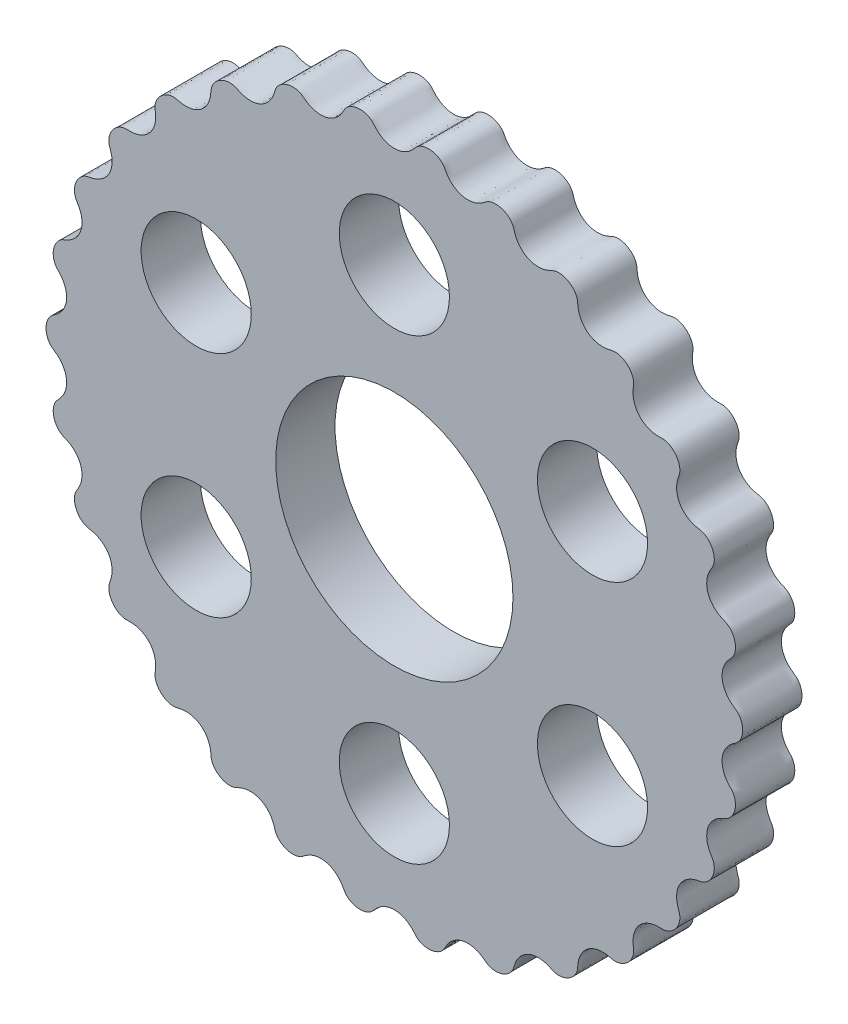
from build123d import *

# Parameters (mm, degrees)
BOSS_EXTRUDE1_DEPTH = 7
SKETCH2_R           = 14
SKETCH2_R_2         = 6.5
CUT_EXTRUDE1_DEPTH  = 7


with BuildPart() as part:
    # Sketch1 → Boss-Extrude1 (new body)
    with BuildSketch(Plane.XY):
        with BuildLine():
            add(Edge.make_bspline(
                [(0, 38.9), (-0.630492424, 38.9), (-1.507013809, 39.217935071), (-2.196153104, 39.883196365), (-2.445341751, 40.178253442), (-2.571992678, 40.32066814), (-2.681349487, 40.425517942), (-2.809944847, 40.526907485), (-2.973304425, 40.629709251), (-3.176800411, 40.727717742), (-3.419090297, 40.810842329), (-3.693708308, 40.869006469), (-3.990480724, 40.894065816), (-4.29679965, 40.881326059), (-4.599074779, 40.830101408), (-4.884145734, 40.743874526), (-5.140682904, 40.629908207), (-5.36038395, 40.498205779), (-5.539064473, 40.360040785), (-5.677478587, 40.225518623), (-5.782175767, 40.099602717), (-5.867354666, 39.974315241), (-5.961619102, 39.808677807), (-6.144029357, 39.468264415), (-6.67978179, 38.674256059), (-8.04021473, 37.826243325), (-9.62794908, 38.04759685), (-10.440343282, 38.555046737), (-10.745427864, 38.791853049), (-10.898927237, 38.904814317), (-11.027696065, 38.984639921), (-11.174563439, 39.05707845), (-11.355724996, 39.123677922), (-11.575154651, 39.177213487), (-11.829427309, 39.208171264), (-12.110136892, 39.207949424), (-12.405631967, 39.170759843), (-12.702610528, 39.094614488), (-12.987629395, 38.981660874), (-13.248547336, 38.83805817), (-13.475771321, 38.673232455), (-13.66329128, 38.498733719), (-13.809355492, 38.326450962), (-13.916762866, 38.166078742), (-13.993002198, 38.021150308), (-14.050263359, 37.88088461), (-14.108032797, 37.699271087), (-14.215666356, 37.328370118), (-14.574647139, 36.440327484), (-15.729037739, 35.328002866), (-17.328099614, 35.214402357), (-18.228241289, 35.541857222), (-18.575896924, 35.71005183), (-18.749525455, 35.788632305), (-18.89207393, 35.839947641), (-19.050792281, 35.880256959), (-19.241839885, 35.907738927), (-19.467605668, 35.91449157), (-19.722762356, 35.891901976), (-19.99729056, 35.833312388), (-20.278605163, 35.735521303), (-20.553254878, 35.599276839), (-20.808559126, 35.429535881), (-21.033921838, 35.234827937), (-21.221909066, 35.026359327), (-21.369060652, 34.816690443), (-21.476098062, 34.617793368), (-21.547821131, 34.438600482), (-21.592265955, 34.280991336), (-21.619115049, 34.131885661), (-21.637854771, 33.942226341), (-21.66604331, 33.557051812), (-21.832520165, 32.613778538), (-22.730428155, 31.285740268), (-24.270924496, 30.842182463), (-25.219480384, 30.975314203), (-25.594504604, 31.06756283), (-25.780678641, 31.108324185), (-25.930781789, 31.128871943), (-26.094413844, 31.13531433), (-26.287000211, 31.122475482), (-26.50923637, 31.082128619), (-26.754114778, 31.006973492), (-27.010474973, 30.892611245), (-27.265300867, 30.738452313), (-27.505623243, 30.54808966), (-27.720061689, 30.32897865), (-27.900002529, 30.091658833), (-28.040560543, 29.848671354), (-28.140882953, 29.612981523), (-28.2042417, 29.396183563), (-28.23713109, 29.205991222), (-28.247848028, 29.042585727), (-28.243088158, 28.891154205), (-28.222018671, 28.701741142), (-28.169464404, 28.319126135), (-28.136239068, 27.361851411), (-28.738367107, 25.876144044), (-30.152997736, 25.122009816), (-31.108501576, 25.055002809), (-31.494510984, 25.067253827), (-31.685090706, 25.068438266), (-31.836187424, 25.057314441), (-31.99758155, 25.029600509), (-32.183292364, 24.976996007), (-32.392287537, 24.891335581), (-32.616187461, 24.766902224), (-32.843161391, 24.601731654), (-33.060368836, 24.397963574), (-33.255866525, 24.161798966), (-33.420058628, 23.902890762), (-33.546730698, 23.633346789), (-33.633692193, 23.366444937), (-33.682826434, 23.115047721), (-33.699724382, 22.88981453), (-33.692358684, 22.696937821), (-33.668849388, 22.534878239), (-33.632724923, 22.387742856), (-33.572719547, 22.206853981), (-33.441777323, 21.843522023), (-33.210222344, 20.91407875), (-33.490332752, 19.335645208), (-34.717241294, 18.303883939), (-35.637930527, 18.039651465), (-36.018061641, 17.971414262), (-36.20471553, 17.932915054), (-36.35020146, 17.890648064), (-36.50230416, 17.82997369), (-36.673012169, 17.739898476), (-36.859636202, 17.612665569), (-37.052773422, 17.444402144), (-37.240456184, 17.235658559), (-37.410532347, 16.991170983), (-37.552671798, 16.719529853), (-37.65944319, 16.432137416), (-37.72730586, 16.142144457), (-37.756861629, 15.862991645), (-37.752661979, 15.606873087), (-37.722362601, 15.383046448), (-37.675063407, 15.195917324), (-37.618375899, 15.04228445), (-37.552441956, 14.905882795), (-37.456141529, 14.741418706), (-37.252521838, 14.413250075), (-36.832777932, 13.552260549), (-36.778600825, 11.950088288), (-37.764166468, 10.685752764), (-38.609822012, 10.235919989), (-38.967441031, 10.09010357), (-39.142026293, 10.01366505), (-39.275540964, 9.942060529), (-39.411699433, 9.851080188), (-39.559963175, 9.727498427), (-39.716040963, 9.564231732), (-39.869986011, 9.359501014), (-40.010148813, 9.116287907), (-40.125702225, 8.841791452), (-40.208239042, 8.546523521), (-40.252926249, 8.243215252), (-40.259023091, 7.9454517), (-40.229886252, 7.666259237), (-40.172539599, 7.416604801), (-40.096343599, 7.203975882), (-40.011174953, 7.030767617), (-39.923787782, 6.892275806), (-39.830937964, 6.77255698), (-39.702544231, 6.631715374), (-39.435149965, 6.353051366), (-38.845572855, 5.598149936), (-38.459454669, 4.042253838), (-39.160626603, 2.600635886), (-39.894274826, 1.984810097), (-40.213759659, 1.767822372), (-40.368635011, 1.656757458), (-40.484341838, 1.55895387), (-40.598616998, 1.441660628), (-40.717929888, 1.289941498), (-40.836673854, 1.097808015), (-40.944668583, 0.865531334), (-41.031208547, 0.598493773), (-41.087168402, 0.305970765), (-41.106509005, 0), (-41.087168402, -0.305970765), (-41.031208547, -0.598493773), (-40.944668583, -0.865531334), (-40.836673854, -1.097808015), (-40.717929888, -1.289941498), (-40.598616998, -1.441660628), (-40.484341838, -1.55895387), (-40.368635011, -1.656757458), (-40.213759659, -1.767822372), (-39.894274826, -1.984810097), (-39.160626603, -2.600635886), (-38.459454669, -4.042253838), (-38.845572855, -5.598149936), (-39.435149965, -6.353051366), (-39.702544231, -6.631715374), (-39.830937964, -6.77255698), (-39.923787782, -6.892275806), (-40.011174953, -7.030767617), (-40.096343599, -7.203975882), (-40.172539599, -7.416604801), (-40.229886252, -7.666259237), (-40.259023091, -7.9454517), (-40.252926249, -8.243215252), (-40.208239042, -8.546523521), (-40.125702225, -8.841791452), (-40.010148813, -9.116287907), (-39.869986011, -9.359501014), (-39.716040963, -9.564231732), (-39.559963175, -9.727498427), (-39.411699433, -9.851080188), (-39.275540964, -9.942060529), (-39.142026293, -10.01366505), (-38.967441031, -10.09010357), (-38.609822012, -10.235919989), (-37.764166468, -10.685752764), (-36.778600825, -11.950088288), (-36.832777932, -13.552260549), (-37.252521838, -14.413250075), (-37.456141529, -14.741418706), (-37.552441956, -14.905882795), (-37.618375899, -15.04228445), (-37.675063407, -15.195917324), (-37.722362601, -15.383046448), (-37.752661979, -15.606873087), (-37.756861629, -15.862991645), (-37.72730586, -16.142144457), (-37.65944319, -16.432137416), (-37.552671798, -16.719529853), (-37.410532347, -16.991170983), (-37.240456184, -17.235658559), (-37.052773422, -17.444402144), (-36.859636202, -17.612665569), (-36.673012169, -17.739898476), (-36.50230416, -17.82997369), (-36.35020146, -17.890648064), (-36.20471553, -17.932915054), (-36.018061641, -17.971414262), (-35.637930527, -18.039651465), (-34.717241294, -18.303883939), (-33.490332752, -19.335645208), (-33.210222344, -20.91407875), (-33.441777323, -21.843522023), (-33.572719547, -22.206853981), (-33.632724923, -22.387742856), (-33.668849388, -22.534878239), (-33.692358684, -22.696937821), (-33.699724382, -22.88981453), (-33.682826434, -23.115047721), (-33.633692193, -23.366444937), (-33.546730698, -23.633346789), (-33.420058628, -23.902890762), (-33.255866525, -24.161798966), (-33.060368836, -24.397963574), (-32.843161391, -24.601731654), (-32.616187461, -24.766902224), (-32.392287537, -24.891335581), (-32.183292364, -24.976996007), (-31.99758155, -25.029600509), (-31.836187424, -25.057314441), (-31.685090706, -25.068438266), (-31.494510984, -25.067253827), (-31.108501576, -25.055002809), (-30.152997736, -25.122009816), (-28.738367107, -25.876144044), (-28.136239068, -27.361851411), (-28.169464404, -28.319126135), (-28.222018671, -28.701741142), (-28.243088158, -28.891154205), (-28.247848028, -29.042585727), (-28.23713109, -29.205991222), (-28.2042417, -29.396183563), (-28.140882953, -29.612981523), (-28.040560543, -29.848671354), (-27.900002529, -30.091658833), (-27.720061689, -30.32897865), (-27.505623243, -30.54808966), (-27.265300867, -30.738452313), (-27.010474973, -30.892611245), (-26.754114778, -31.006973492), (-26.50923637, -31.082128619), (-26.287000211, -31.122475482), (-26.094413844, -31.13531433), (-25.930781789, -31.128871943), (-25.780678641, -31.108324185), (-25.594504604, -31.06756283), (-25.219480384, -30.975314203), (-24.270924496, -30.842182463), (-22.730428155, -31.285740268), (-21.832520165, -32.613778538), (-21.66604331, -33.557051812), (-21.637854771, -33.942226341), (-21.619115049, -34.131885661), (-21.592265955, -34.280991336), (-21.547821131, -34.438600482), (-21.476098062, -34.617793368), (-21.369060652, -34.816690443), (-21.221909066, -35.026359327), (-21.033921838, -35.234827937), (-20.808559126, -35.429535881), (-20.553254878, -35.599276839), (-20.278605163, -35.735521303), (-19.99729056, -35.833312388), (-19.722762356, -35.891901976), (-19.467605668, -35.91449157), (-19.241839885, -35.907738927), (-19.050792281, -35.880256959), (-18.89207393, -35.839947641), (-18.749525455, -35.788632305), (-18.575896924, -35.71005183), (-18.228241289, -35.541857222), (-17.328099614, -35.214402357), (-15.729037739, -35.328002866), (-14.574647139, -36.440327484), (-14.215666356, -37.328370118), (-14.108032797, -37.699271087), (-14.050263359, -37.88088461), (-13.993002198, -38.021150308), (-13.916762866, -38.166078742), (-13.809355492, -38.326450962), (-13.66329128, -38.498733719), (-13.475771321, -38.673232455), (-13.248547336, -38.83805817), (-12.987629395, -38.981660874), (-12.702610528, -39.094614488), (-12.405631967, -39.170759843), (-12.110136892, -39.207949424), (-11.829427309, -39.208171264), (-11.575154651, -39.177213487), (-11.355724996, -39.123677922), (-11.174563439, -39.05707845), (-11.027696065, -38.984639921), (-10.898927237, -38.904814317), (-10.745427864, -38.791853049), (-10.440343282, -38.555046737), (-9.62794908, -38.04759685), (-8.04021473, -37.826243325), (-6.67978179, -38.674256059), (-6.144029357, -39.468264415), (-5.961619102, -39.808677807), (-5.867354666, -39.974315241), (-5.782175767, -40.099602717), (-5.677478587, -40.225518623), (-5.539064473, -40.360040785), (-5.36038395, -40.498205779), (-5.140682904, -40.629908207), (-4.884145734, -40.743874526), (-4.599074779, -40.830101408), (-4.29679965, -40.881326059), (-3.990480724, -40.894065816), (-3.693708308, -40.869006469), (-3.419090297, -40.810842329), (-3.176800411, -40.727717742), (-2.973304425, -40.629709251), (-2.809944847, -40.526907485), (-2.681349487, -40.425517942), (-2.571992678, -40.32066814), (-2.445341751, -40.178253442), (-2.196153104, -39.883196365), (-1.507013809, -39.217935071), (0, -38.671305462), (1.507013809, -39.217935071), (2.196153104, -39.883196365), (2.445341751, -40.178253442), (2.571992678, -40.32066814), (2.681349487, -40.425517942), (2.809944847, -40.526907485), (2.973304425, -40.629709251), (3.176800411, -40.727717742), (3.419090297, -40.810842329), (3.693708308, -40.869006469), (3.990480724, -40.894065816), (4.29679965, -40.881326059), (4.599074779, -40.830101408), (4.884145734, -40.743874526), (5.140682904, -40.629908207), (5.36038395, -40.498205779), (5.539064473, -40.360040785), (5.677478587, -40.225518623), (5.782175767, -40.099602717), (5.867354666, -39.974315241), (5.961619102, -39.808677807), (6.144029357, -39.468264415), (6.67978179, -38.674256059), (8.04021473, -37.826243325), (9.62794908, -38.04759685), (10.440343282, -38.555046737), (10.745427864, -38.791853049), (10.898927237, -38.904814317), (11.027696065, -38.984639921), (11.174563439, -39.05707845), (11.355724996, -39.123677922), (11.575154651, -39.177213487), (11.829427309, -39.208171264), (12.110136892, -39.207949424), (12.405631967, -39.170759843), (12.702610528, -39.094614488), (12.987629395, -38.981660874), (13.248547336, -38.83805817), (13.475771321, -38.673232455), (13.66329128, -38.498733719), (13.809355492, -38.326450962), (13.916762866, -38.166078742), (13.993002198, -38.021150308), (14.050263359, -37.88088461), (14.108032797, -37.699271087), (14.215666356, -37.328370118), (14.574647139, -36.440327484), (15.729037739, -35.328002866), (17.328099614, -35.214402357), (18.228241289, -35.541857222), (18.575896924, -35.71005183), (18.749525455, -35.788632305), (18.89207393, -35.839947641), (19.050792281, -35.880256959), (19.241839885, -35.907738927), (19.467605668, -35.91449157), (19.722762356, -35.891901976), (19.99729056, -35.833312388), (20.278605163, -35.735521303), (20.553254878, -35.599276839), (20.808559126, -35.429535881), (21.033921838, -35.234827937), (21.221909066, -35.026359327), (21.369060652, -34.816690443), (21.476098062, -34.617793368), (21.547821131, -34.438600482), (21.592265955, -34.280991336), (21.619115049, -34.131885661), (21.637854771, -33.942226341), (21.66604331, -33.557051812), (21.832520165, -32.613778538), (22.730428155, -31.285740268), (24.270924496, -30.842182463), (25.219480384, -30.975314203), (25.594504604, -31.06756283), (25.780678641, -31.108324185), (25.930781789, -31.128871943), (26.094413844, -31.13531433), (26.287000211, -31.122475482), (26.50923637, -31.082128619), (26.754114778, -31.006973492), (27.010474973, -30.892611245), (27.265300867, -30.738452313), (27.505623243, -30.54808966), (27.720061689, -30.32897865), (27.900002529, -30.091658833), (28.040560543, -29.848671354), (28.140882953, -29.612981523), (28.2042417, -29.396183563), (28.23713109, -29.205991222), (28.247848028, -29.042585727), (28.243088158, -28.891154205), (28.222018671, -28.701741142), (28.169464404, -28.319126135), (28.136239068, -27.361851411), (28.738367107, -25.876144044), (30.152997736, -25.122009816), (31.108501576, -25.055002809), (31.494510984, -25.067253827), (31.685090706, -25.068438266), (31.836187424, -25.057314441), (31.99758155, -25.029600509), (32.183292364, -24.976996007), (32.392287537, -24.891335581), (32.616187461, -24.766902224), (32.843161391, -24.601731654), (33.060368836, -24.397963574), (33.255866525, -24.161798966), (33.420058628, -23.902890762), (33.546730698, -23.633346789), (33.633692193, -23.366444937), (33.682826434, -23.115047721), (33.699724382, -22.88981453), (33.692358684, -22.696937821), (33.668849388, -22.534878239), (33.632724923, -22.387742856), (33.572719547, -22.206853981), (33.441777323, -21.843522023), (33.210222344, -20.91407875), (33.490332752, -19.335645208), (34.717241294, -18.303883939), (35.637930527, -18.039651465), (36.018061641, -17.971414262), (36.20471553, -17.932915054), (36.35020146, -17.890648064), (36.50230416, -17.82997369), (36.673012169, -17.739898476), (36.859636202, -17.612665569), (37.052773422, -17.444402144), (37.240456184, -17.235658559), (37.410532347, -16.991170983), (37.552671798, -16.719529853), (37.65944319, -16.432137416), (37.72730586, -16.142144457), (37.756861629, -15.862991645), (37.752661979, -15.606873087), (37.722362601, -15.383046448), (37.675063407, -15.195917324), (37.618375899, -15.04228445), (37.552441956, -14.905882795), (37.456141529, -14.741418706), (37.252521838, -14.413250075), (36.832777932, -13.552260549), (36.778600825, -11.950088288), (37.764166468, -10.685752764), (38.609822012, -10.235919989), (38.967441031, -10.09010357), (39.142026293, -10.01366505), (39.275540964, -9.942060529), (39.411699433, -9.851080188), (39.559963175, -9.727498427), (39.716040963, -9.564231732), (39.869986011, -9.359501014), (40.010148813, -9.116287907), (40.125702225, -8.841791452), (40.208239042, -8.546523521), (40.252926249, -8.243215252), (40.259023091, -7.9454517), (40.229886252, -7.666259237), (40.172539599, -7.416604801), (40.096343599, -7.203975882), (40.011174953, -7.030767617), (39.923787782, -6.892275806), (39.830937964, -6.77255698), (39.702544231, -6.631715374), (39.435149965, -6.353051366), (38.845572855, -5.598149936), (38.459454669, -4.042253838), (39.160626603, -2.600635886), (39.894274826, -1.984810097), (40.213759659, -1.767822372), (40.368635011, -1.656757458), (40.484341838, -1.55895387), (40.598616998, -1.441660628), (40.717929888, -1.289941498), (40.836673854, -1.097808015), (40.944668583, -0.865531334), (41.031208547, -0.598493773), (41.087168402, -0.305970765), (41.106509005, 0), (41.087168402, 0.305970765), (41.031208547, 0.598493773), (40.944668583, 0.865531334), (40.836673854, 1.097808015), (40.717929888, 1.289941498), (40.598616998, 1.441660628), (40.484341838, 1.55895387), (40.368635011, 1.656757458), (40.213759659, 1.767822372), (39.894274826, 1.984810097), (39.160626603, 2.600635886), (38.459454669, 4.042253838), (38.845572855, 5.598149936), (39.435149965, 6.353051366), (39.702544231, 6.631715374), (39.830937964, 6.77255698), (39.923787782, 6.892275806), (40.011174953, 7.030767617), (40.096343599, 7.203975882), (40.172539599, 7.416604801), (40.229886252, 7.666259237), (40.259023091, 7.9454517), (40.252926249, 8.243215252), (40.208239042, 8.546523521), (40.125702225, 8.841791452), (40.010148813, 9.116287907), (39.869986011, 9.359501014), (39.716040963, 9.564231732), (39.559963175, 9.727498427), (39.411699433, 9.851080188), (39.275540964, 9.942060529), (39.142026293, 10.01366505), (38.967441031, 10.09010357), (38.609822012, 10.235919989), (37.764166468, 10.685752764), (36.778600825, 11.950088288), (36.832777932, 13.552260549), (37.252521838, 14.413250075), (37.456141529, 14.741418706), (37.552441956, 14.905882795), (37.618375899, 15.04228445), (37.675063407, 15.195917324), (37.722362601, 15.383046448), (37.752661979, 15.606873087), (37.756861629, 15.862991645), (37.72730586, 16.142144457), (37.65944319, 16.432137416), (37.552671798, 16.719529853), (37.410532347, 16.991170983), (37.240456184, 17.235658559), (37.052773422, 17.444402144), (36.859636202, 17.612665569), (36.673012169, 17.739898476), (36.50230416, 17.82997369), (36.35020146, 17.890648064), (36.20471553, 17.932915054), (36.018061641, 17.971414262), (35.637930527, 18.039651465), (34.717241294, 18.303883939), (33.490332752, 19.335645208), (33.210222344, 20.91407875), (33.441777323, 21.843522023), (33.572719547, 22.206853981), (33.632724923, 22.387742856), (33.668849388, 22.534878239), (33.692358684, 22.696937821), (33.699724382, 22.88981453), (33.682826434, 23.115047721), (33.633692193, 23.366444937), (33.546730698, 23.633346789), (33.420058628, 23.902890762), (33.255866525, 24.161798966), (33.060368836, 24.397963574), (32.843161391, 24.601731654), (32.616187461, 24.766902224), (32.392287537, 24.891335581), (32.183292364, 24.976996007), (31.99758155, 25.029600509), (31.836187424, 25.057314441), (31.685090706, 25.068438266), (31.494510984, 25.067253827), (31.108501576, 25.055002809), (30.152997736, 25.122009816), (28.738367107, 25.876144044), (28.136239068, 27.361851411), (28.169464404, 28.319126135), (28.222018671, 28.701741142), (28.243088158, 28.891154205), (28.247848028, 29.042585727), (28.23713109, 29.205991222), (28.2042417, 29.396183563), (28.140882953, 29.612981523), (28.040560543, 29.848671354), (27.900002529, 30.091658833), (27.720061689, 30.32897865), (27.505623243, 30.54808966), (27.265300867, 30.738452313), (27.010474973, 30.892611245), (26.754114778, 31.006973492), (26.50923637, 31.082128619), (26.287000211, 31.122475482), (26.094413844, 31.13531433), (25.930781789, 31.128871943), (25.780678641, 31.108324185), (25.594504604, 31.06756283), (25.219480384, 30.975314203), (24.270924496, 30.842182463), (22.730428155, 31.285740268), (21.832520165, 32.613778538), (21.66604331, 33.557051812), (21.637854771, 33.942226341), (21.619115049, 34.131885661), (21.592265955, 34.280991336), (21.547821131, 34.438600482), (21.476098062, 34.617793368), (21.369060652, 34.816690443), (21.221909066, 35.026359327), (21.033921838, 35.234827937), (20.808559126, 35.429535881), (20.553254878, 35.599276839), (20.278605163, 35.735521303), (19.99729056, 35.833312388), (19.722762356, 35.891901976), (19.467605668, 35.91449157), (19.241839885, 35.907738927), (19.050792281, 35.880256959), (18.89207393, 35.839947641), (18.749525455, 35.788632305), (18.575896924, 35.71005183), (18.228241289, 35.541857222), (17.328099614, 35.214402357), (15.729037739, 35.328002866), (14.574647139, 36.440327484), (14.215666356, 37.328370118), (14.108032797, 37.699271087), (14.050263359, 37.88088461), (13.993002198, 38.021150308), (13.916762866, 38.166078742), (13.809355492, 38.326450962), (13.66329128, 38.498733719), (13.475771321, 38.673232455), (13.248547336, 38.83805817), (12.987629395, 38.981660874), (12.702610528, 39.094614488), (12.405631967, 39.170759843), (12.110136892, 39.207949424), (11.829427309, 39.208171264), (11.575154651, 39.177213487), (11.355724996, 39.123677922), (11.174563439, 39.05707845), (11.027696065, 38.984639921), (10.898927237, 38.904814317), (10.745427864, 38.791853049), (10.440343282, 38.555046737), (9.62794908, 38.04759685), (8.04021473, 37.826243325), (6.67978179, 38.674256059), (6.144029357, 39.468264415), (5.961619102, 39.808677807), (5.867354666, 39.974315241), (5.782175767, 40.099602717), (5.677478587, 40.225518623), (5.539064473, 40.360040785), (5.36038395, 40.498205779), (5.140682904, 40.629908207), (4.884145734, 40.743874526), (4.599074779, 40.830101408), (4.29679965, 40.881326059), (3.990480724, 40.894065816), (3.693708308, 40.869006469), (3.419090297, 40.810842329), (3.176800411, 40.727717742), (2.973304425, 40.629709251), (2.809944847, 40.526907485), (2.681349487, 40.425517942), (2.571992678, 40.32066814), (2.445341751, 40.178253442), (2.196153104, 39.883196365), (1.507013809, 39.217935071), (0.630492424, 38.9), (0, 38.9)],
                knots=[0, 0, 0, 0, 0.006348582, 0.008825908, 0.009770855, 0.010301446, 0.010775814, 0.011319554, 0.011974745, 0.012747462, 0.013626243, 0.014590256, 0.015613378, 0.01666667, 0.017719953, 0.018743074, 0.019707087, 0.02058589, 0.021358581, 0.022013784, 0.022557531, 0.023031878, 0.023562484, 0.02450741, 0.026984762, 0.033333319, 0.039681906, 0.042159254, 0.043104187, 0.043634771, 0.044109159, 0.044652926, 0.045308096, 0.046080813, 0.046959599, 0.047923589, 0.048946712, 0.050000013, 0.051053294, 0.052076414, 0.053040414, 0.053919201, 0.054691927, 0.055347095, 0.055890868, 0.056365237, 0.056895823, 0.05784073, 0.060318086, 0.066666679, 0.073015235, 0.075492589, 0.07643751, 0.076968099, 0.077442482, 0.077986239, 0.078641391, 0.079414128, 0.080292917, 0.081256922, 0.082280048, 0.083333339, 0.084386628, 0.085409729, 0.086373727, 0.087252542, 0.088025256, 0.08868043, 0.089224181, 0.089698542, 0.090229159, 0.091174071, 0.093651415, 0.099999999, 0.106348569, 0.108825896, 0.109770826, 0.110301421, 0.110775799, 0.111319553, 0.111974735, 0.112747435, 0.11362625, 0.114590249, 0.115613367, 0.116666665, 0.117719931, 0.118743053, 0.119707064, 0.12058586, 0.121358574, 0.122013737, 0.122557516, 0.123031861, 0.123562494, 0.124507397, 0.126984748, 0.133333312, 0.139681898, 0.142159222, 0.143104138, 0.143634759, 0.144109114, 0.14465289, 0.14530805, 0.146080786, 0.146959588, 0.147923578, 0.148946708, 0.149999995, 0.151053261, 0.152076379, 0.1530404, 0.153919181, 0.154691908, 0.155347072, 0.155890851, 0.156365193, 0.156895819, 0.157840731, 0.160318086, 0.166666657, 0.173015217, 0.175492556, 0.176437496, 0.1769681, 0.177442453, 0.177986208, 0.178641393, 0.179414108, 0.180292908, 0.181256917, 0.182280026, 0.18333331, 0.184386599, 0.185409724, 0.186373737, 0.187252539, 0.188025248, 0.188680429, 0.18922418, 0.189698546, 0.190229138, 0.191174084, 0.193651433, 0.199999998, 0.20634858, 0.208825894, 0.209770839, 0.210301446, 0.210775814, 0.211319567, 0.211974749, 0.212747461, 0.213626254, 0.214590259, 0.215613371, 0.216666674, 0.217719976, 0.218743055, 0.219707076, 0.220585877, 0.221358606, 0.222013776, 0.222557533, 0.223031902, 0.223562518, 0.224507411, 0.22698476, 0.233333332, 0.23968191, 0.242159268, 0.243104174, 0.243634783, 0.244109157, 0.244652913, 0.24530808, 0.246080798, 0.246959583, 0.247923609, 0.248946722, 0.25, 0.251053278, 0.252076391, 0.253040417, 0.253919202, 0.25469192, 0.255347087, 0.255890843, 0.256365217, 0.256895826, 0.257840732, 0.26031809, 0.266666668, 0.27301524, 0.275492589, 0.276437482, 0.276968098, 0.277442467, 0.277986224, 0.278641394, 0.279414123, 0.280292924, 0.281256945, 0.282280024, 0.283333326, 0.284386629, 0.285409741, 0.286373746, 0.287252539, 0.288025251, 0.288680433, 0.289224186, 0.289698554, 0.290229161, 0.291174106, 0.29365142, 0.300000002, 0.306348567, 0.308825916, 0.309770862, 0.310301454, 0.31077582, 0.311319571, 0.311974752, 0.312747461, 0.313626263, 0.314590276, 0.315613401, 0.31666669, 0.317719974, 0.318743083, 0.319707092, 0.320585892, 0.321358607, 0.322013792, 0.322557547, 0.3230319, 0.323562504, 0.324507444, 0.326984783, 0.333333343, 0.339681914, 0.342159269, 0.343104181, 0.343634807, 0.344109149, 0.344652928, 0.345308092, 0.346080819, 0.3469596, 0.347923621, 0.348946739, 0.350000005, 0.351053292, 0.352076422, 0.353040412, 0.353919214, 0.35469195, 0.35534711, 0.355890886, 0.356365241, 0.356895862, 0.357840778, 0.360318102, 0.366666688, 0.373015252, 0.375492603, 0.376437506, 0.376968139, 0.377442484, 0.377986263, 0.378641426, 0.37941414, 0.380292936, 0.381256947, 0.382280069, 0.383333335, 0.384386633, 0.385409751, 0.38637375, 0.387252565, 0.388025265, 0.388680447, 0.389224201, 0.389698579, 0.390229174, 0.391174104, 0.393651431, 0.400000001, 0.406348585, 0.408825929, 0.409770841, 0.410301458, 0.410775819, 0.41131957, 0.411974744, 0.412747458, 0.413626273, 0.414590271, 0.415613372, 0.416666661, 0.417719952, 0.418743078, 0.419707083, 0.420585872, 0.421358609, 0.422013761, 0.422557518, 0.423031901, 0.42356249, 0.424507411, 0.426984765, 0.433333321, 0.439681914, 0.44215927, 0.443104177, 0.443634763, 0.444109132, 0.444652905, 0.445308073, 0.446080799, 0.446959586, 0.447923586, 0.448946706, 0.449999987, 0.451053288, 0.452076411, 0.453040401, 0.453919187, 0.454691904, 0.455347074, 0.455890841, 0.456365229, 0.456895813, 0.457840746, 0.460318094, 0.466666681, 0.473015238, 0.47549259, 0.476437516, 0.476968122, 0.477442469, 0.477986216, 0.478641419, 0.47941411, 0.480292913, 0.481256926, 0.482280047, 0.48333333, 0.484386622, 0.485409744, 0.486373757, 0.487252538, 0.488025255, 0.488680446, 0.489224186, 0.489698554, 0.490229145, 0.491174092, 0.493651418, 0.5, 0.506348582, 0.508825908, 0.509770855, 0.510301446, 0.510775814, 0.511319554, 0.511974745, 0.512747462, 0.513626243, 0.514590256, 0.515613378, 0.51666667, 0.517719953, 0.518743074, 0.519707087, 0.52058589, 0.521358581, 0.522013784, 0.522557531, 0.523031878, 0.523562484, 0.52450741, 0.526984762, 0.533333319, 0.539681906, 0.542159254, 0.543104187, 0.543634771, 0.544109159, 0.544652926, 0.545308096, 0.546080813, 0.546959599, 0.547923589, 0.548946712, 0.550000013, 0.551053294, 0.552076414, 0.553040414, 0.553919201, 0.554691927, 0.555347095, 0.555890868, 0.556365237, 0.556895823, 0.55784073, 0.560318086, 0.566666679, 0.573015235, 0.575492589, 0.57643751, 0.576968099, 0.577442482, 0.577986239, 0.578641391, 0.579414128, 0.580292917, 0.581256922, 0.582280048, 0.583333339, 0.584386628, 0.585409729, 0.586373727, 0.587252542, 0.588025256, 0.58868043, 0.589224181, 0.589698542, 0.590229159, 0.591174071, 0.593651415, 0.599999999, 0.606348569, 0.608825896, 0.609770826, 0.610301421, 0.610775799, 0.611319553, 0.611974735, 0.612747435, 0.61362625, 0.614590249, 0.615613367, 0.616666665, 0.617719931, 0.618743053, 0.619707064, 0.62058586, 0.621358574, 0.622013737, 0.622557516, 0.623031861, 0.623562494, 0.624507397, 0.626984748, 0.633333312, 0.639681898, 0.642159222, 0.643104138, 0.643634759, 0.644109114, 0.64465289, 0.64530805, 0.646080786, 0.646959588, 0.647923578, 0.648946708, 0.649999995, 0.651053261, 0.652076379, 0.6530404, 0.653919181, 0.654691908, 0.655347072, 0.655890851, 0.656365193, 0.656895819, 0.657840731, 0.660318086, 0.666666657, 0.673015217, 0.675492556, 0.676437496, 0.6769681, 0.677442453, 0.677986208, 0.678641393, 0.679414108, 0.680292908, 0.681256917, 0.682280026, 0.68333331, 0.684386599, 0.685409724, 0.686373737, 0.687252539, 0.688025248, 0.688680429, 0.68922418, 0.689698546, 0.690229138, 0.691174084, 0.693651433, 0.699999998, 0.70634858, 0.708825894, 0.709770839, 0.710301446, 0.710775814, 0.711319567, 0.711974749, 0.712747461, 0.713626254, 0.714590259, 0.715613371, 0.716666674, 0.717719976, 0.718743055, 0.719707076, 0.720585877, 0.721358606, 0.722013776, 0.722557533, 0.723031902, 0.723562518, 0.724507411, 0.72698476, 0.733333332, 0.73968191, 0.742159268, 0.743104174, 0.743634783, 0.744109157, 0.744652913, 0.74530808, 0.746080798, 0.746959583, 0.747923609, 0.748946722, 0.75, 0.751053278, 0.752076391, 0.753040417, 0.753919202, 0.75469192, 0.755347087, 0.755890843, 0.756365217, 0.756895826, 0.757840732, 0.76031809, 0.766666668, 0.77301524, 0.775492589, 0.776437482, 0.776968098, 0.777442467, 0.777986224, 0.778641394, 0.779414123, 0.780292924, 0.781256945, 0.782280024, 0.783333326, 0.784386629, 0.785409741, 0.786373746, 0.787252539, 0.788025251, 0.788680433, 0.789224186, 0.789698554, 0.790229161, 0.791174106, 0.79365142, 0.800000002, 0.806348567, 0.808825916, 0.809770862, 0.810301454, 0.81077582, 0.811319571, 0.811974752, 0.812747461, 0.813626263, 0.814590276, 0.815613401, 0.81666669, 0.817719974, 0.818743083, 0.819707092, 0.820585892, 0.821358607, 0.822013792, 0.822557547, 0.8230319, 0.823562504, 0.824507444, 0.826984783, 0.833333343, 0.839681914, 0.842159269, 0.843104181, 0.843634807, 0.844109149, 0.844652928, 0.845308092, 0.846080819, 0.8469596, 0.847923621, 0.848946739, 0.850000005, 0.851053292, 0.852076422, 0.853040412, 0.853919214, 0.85469195, 0.85534711, 0.855890886, 0.856365241, 0.856895862, 0.857840778, 0.860318102, 0.866666688, 0.873015252, 0.875492603, 0.876437506, 0.876968139, 0.877442484, 0.877986263, 0.878641426, 0.87941414, 0.880292936, 0.881256947, 0.882280069, 0.883333335, 0.884386633, 0.885409751, 0.88637375, 0.887252565, 0.888025265, 0.888680447, 0.889224201, 0.889698579, 0.890229174, 0.891174104, 0.893651431, 0.900000001, 0.906348585, 0.908825929, 0.909770841, 0.910301458, 0.910775819, 0.91131957, 0.911974744, 0.912747458, 0.913626273, 0.914590271, 0.915613372, 0.916666661, 0.917719952, 0.918743078, 0.919707083, 0.920585872, 0.921358609, 0.922013761, 0.922557518, 0.923031901, 0.92356249, 0.924507411, 0.926984765, 0.933333321, 0.939681914, 0.94215927, 0.943104177, 0.943634763, 0.944109132, 0.944652905, 0.945308073, 0.946080799, 0.946959586, 0.947923586, 0.948946706, 0.949999987, 0.951053288, 0.952076411, 0.953040401, 0.953919187, 0.954691904, 0.955347074, 0.955890841, 0.956365229, 0.956895813, 0.957840746, 0.960318094, 0.966666681, 0.973015238, 0.97549259, 0.976437516, 0.976968122, 0.977442469, 0.977986216, 0.978641419, 0.97941411, 0.980292913, 0.981256926, 0.982280047, 0.98333333, 0.984386622, 0.985409744, 0.986373757, 0.987252538, 0.988025255, 0.988680446, 0.989224186, 0.989698554, 0.990229145, 0.991174092, 0.993651418, 1, 1, 1, 1], degree=3))
        make_face()
    extrude(amount=BOSS_EXTRUDE1_DEPTH)

    # Sketch2 → Cut-Extrude1 (cut)
    with BuildSketch(Plane.XY.offset(7)):
        Circle(SKETCH2_R)
        with Locations((0, 27)):
            Circle(SKETCH2_R_2)
        with Locations((23.382685902, 13.5)):
            Circle(SKETCH2_R_2)
        with Locations((23.382685902, -13.5)):
            Circle(SKETCH2_R_2)
        with Locations((0, -27)):
            Circle(SKETCH2_R_2)
        with Locations((-23.382685902, -13.5)):
            Circle(SKETCH2_R_2)
        with Locations((-23.382685902, 13.5)):
            Circle(SKETCH2_R_2)
    extrude(amount=-CUT_EXTRUDE1_DEPTH, mode=Mode.SUBTRACT)


solid = part.part
